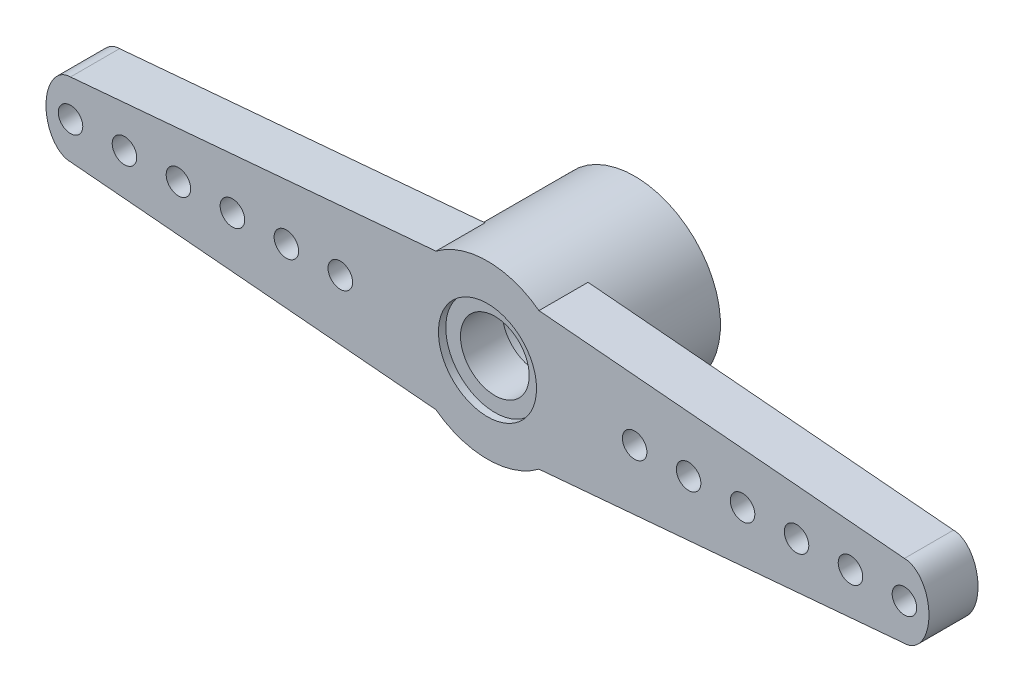
from build123d import *
from build123d.topology import SkipClean

# Parameters (mm, degrees)
CROQUIS1_R              = 0.5
SALIENTE_EXTRUIR1_DEPTH = 2
SALIENTE_EXTRUIR2_START = 4
CROQUIS3_R              = 3.5
CROQUIS3_R_2            = 2.25
SALIENTE_EXTRUIR2_DEPTH = 4
CROQUIS4_R              = 1.4
CORTAR_EXTRUIR1_DEPTH   = 19.768324494
CROQUIS5_R              = 2
CORTAR_EXTRUIR2_DEPTH   = 0.3
CORTAR_EXTRUIR4_DEPTH   = 2


with BuildPart() as part:
    # Croquis1 → Saliente-Extruir1 (new body)
    with BuildSketch(Plane.XY):
        with BuildLine():
            Line((-2.1, 2.8), (-17, 1.5))
            add(Edge.make_bspline(
                [(-17, 1.5), (-18, 1.5), (-18, 0), (-18, -1.5), (-17, -1.5)],
                knots=[3.141592654, 3.141592654, 3.141592654, 4.71238898, 4.71238898, 6.283185307, 6.283185307, 6.283185307], degree=2, weights=[1, 0.707106781, 1, 0.707106781, 1]))
            Line((-17, -1.5), (-2.1, -2.8))
            ThreePointArc((-2.1, -2.8), (0, -3.5), (2.1, -2.8))
            Line((2.1, -2.8), (17, -1.5))
            add(Edge.make_bspline(
                [(17, -1.5), (18, -1.5), (18, 0), (18, 1.5), (17, 1.5)],
                knots=[3.141592654, 3.141592654, 3.141592654, 4.71238898, 4.71238898, 6.283185307, 6.283185307, 6.283185307], degree=2, weights=[1, 0.707106781, 1, 0.707106781, 1]))
            Line((17, 1.5), (2.1, 2.8))
            ThreePointArc((2.1, 2.8), (0, 3.5), (-2.1, 2.8))
        make_face()
        with Locations((-17, 0)):
            Circle(CROQUIS1_R, mode=Mode.SUBTRACT)
        with Locations((-14.8, 0)):
            Circle(CROQUIS1_R, mode=Mode.SUBTRACT)
        with Locations((-12.6, 0)):
            Circle(CROQUIS1_R, mode=Mode.SUBTRACT)
        with Locations((-10.4, 0)):
            Circle(CROQUIS1_R, mode=Mode.SUBTRACT)
        with Locations((-8.2, 0)):
            Circle(CROQUIS1_R, mode=Mode.SUBTRACT)
        with Locations((-6, 0)):
            Circle(CROQUIS1_R, mode=Mode.SUBTRACT)
        with Locations(Location((6, 0, 0), (0, 0, 180))):
            Circle(CROQUIS1_R, mode=Mode.SUBTRACT)
        with Locations(Location((8.2, 0, 0), (0, 0, 180))):
            Circle(CROQUIS1_R, mode=Mode.SUBTRACT)
        with Locations(Location((10.4, 0, 0), (0, 0, 180))):
            Circle(CROQUIS1_R, mode=Mode.SUBTRACT)
        with Locations(Location((12.6, 0, 0), (0, 0, 180))):
            Circle(CROQUIS1_R, mode=Mode.SUBTRACT)
        with Locations(Location((14.8, 0, 0), (0, 0, 180))):
            Circle(CROQUIS1_R, mode=Mode.SUBTRACT)
        with Locations(Location((17, 0, 0), (0, 0, 180))):
            Circle(CROQUIS1_R, mode=Mode.SUBTRACT)
    extrude(amount=SALIENTE_EXTRUIR1_DEPTH)

    # Croquis3 → Saliente-Extruir2 (add)
    with SkipClean():  # the faces are left unmerged after this step: merging them gives an invalid solid
        with BuildSketch(Plane(origin=(0, 0, 0), x_dir=(-1, 0, 0), z_dir=(0, 0, -1)).offset(SALIENTE_EXTRUIR2_START)):
            Circle(CROQUIS3_R)
            Circle(CROQUIS3_R_2, mode=Mode.SUBTRACT)
        extrude(amount=-SALIENTE_EXTRUIR2_DEPTH)

    # Croquis4 → Cortar-Extruir1 (cut, through all)
    with SkipClean():  # the faces are left unmerged after this step: merging them gives an invalid solid
        with BuildSketch(Plane(origin=(0, 0, 0), x_dir=(-1, 0, 0), z_dir=(0, 0, -1))):
            Circle(CROQUIS4_R)
        extrude(amount=-CORTAR_EXTRUIR1_DEPTH, mode=Mode.SUBTRACT)

    # Croquis5 → Cortar-Extruir2 (cut)
    with SkipClean():  # the faces are left unmerged after this step: merging them gives an invalid solid
        with BuildSketch(Plane.XY.offset(2)):
            Circle(CROQUIS5_R)
        extrude(amount=-CORTAR_EXTRUIR2_DEPTH, mode=Mode.SUBTRACT)

    # Croquis6 → Cortar-Extruir4 (cut)
    with SkipClean():  # the faces are left unmerged after this step: merging them gives an invalid solid
        with BuildSketch(Plane(origin=(0, 0, -4), x_dir=(-1, 0, 0), z_dir=(0, 0, -1))):
            Polygon((0, -2.25), (0.10043817, -2.397897449), (0.167368384, -2.394157017), (0.234167805, -2.388546162), (0.31304517, -2.228109749), (0.433089229, -2.360589579), (0.498847515, -2.347570664), (0.564215969, -2.33271773), (0.619997273, -2.162865066), (0.757310699, -2.277348707), (0.820617148, -2.255304706), (0.883282311, -2.23149879), (0.914881833, -2.055535863), (1.066791978, -2.149795022), (1.126414401, -2.119154997), (1.185156568, -2.086859453), (1.191959259, -1.908211182), (1.355509365, -1.980411211), (1.410287279, -1.941771536), (1.4639631, -1.90161496), (1.445836554, -1.723758531), (1.617843304, -1.772494138), (1.666710519, -1.72660689), (1.714275256, -1.679370884), (1.671572286, -1.505768069), (1.848687763, -1.530090672), (1.890693135, -1.477848993), (1.931220994, -1.424452954), (1.864772764, -1.258482734), (2.043549617, -1.257918921), (2.07787556, -1.200339636), (2.110577712, -1.141822856), (2.021677561, -0.986715653), (2.198636103, -0.961276398), (2.2246145, -0.899480223), (2.248854435, -0.836981664), (2.139232704, -0.695756463), (2.310928638, -0.645936912), (2.32805385, -0.581126639), (2.343359765, -0.515862765), (2.215150116, -0.391268354), (2.378241576, -0.318038189), (2.38618028, -0.251475276), (2.392254263, -0.184716373), (2.247952151, -0.079177841), (2.399264746, 0.016037597), (2.397862424, 0.083057578), (2.394586253, 0.150012123), (2.237000354, 0.234440589), (2.373588958, 0.349788041), (2.362872904, 0.415960623), (2.350310345, 0.481807615), (2.18250789, 0.543482711), (2.30171396, 0.676717069), (2.281892751, 0.740754277), (2.260288319, 0.804212081), (2.085535392, 0.841933371), (2.185038718, 0.990461379), (2.156498151, 1.051116803), (2.126272353, 1.110950284), (1.94797032, 1.123983566), (2.025834183, 1.284914297), (1.989129768, 1.341007347), (1.950870913, 1.396051915), (1.772490222, 1.384143511), (1.82719909, 1.55434463), (1.783045236, 1.604783519), (1.737497991, 1.653967793), (1.562510617, 1.617349487), (1.592999645, 1.793508224), (1.542255757, 1.837311216), (1.490306646, 1.879677881), (1.322118521, 1.819062407), (1.327794274, 1.997750031), (1.271448023, 2.034064551), (1.214108178, 2.068788988), (1.055992892, 1.985356156), (1.036744898, 2.163094717), (0.975893001, 2.191213944), (0.914278475, 2.217620281), (0.769313562, 2.112994017), (0.725516462, 2.286324036), (0.661343331, 2.305700661), (0.596653382, 2.323274929), (0.467660419, 2.199491664), (0.400166673, 2.365039469), (0.333921365, 2.375296349), (0.267415109, 2.383696484), (0.156904797, 2.243165519), (0.067028095, 2.397708909), (0, 2.398646405), (-0.067028095, 2.397708909), (-0.156904797, 2.243165519), (-0.267415109, 2.383696484), (-0.333921365, 2.375296349), (-0.400166673, 2.365039469), (-0.467660419, 2.199491664), (-0.596653382, 2.323274929), (-0.661343331, 2.305700661), (-0.725516462, 2.286324036), (-0.769313562, 2.112994017), (-0.914278475, 2.217620281), (-0.975893001, 2.191213944), (-1.036744898, 2.163094717), (-1.055992892, 1.985356156), (-1.214108178, 2.068788988), (-1.271448023, 2.034064551), (-1.327794274, 1.997750031), (-1.322118521, 1.819062407), (-1.490306646, 1.879677881), (-1.542255757, 1.837311216), (-1.592999645, 1.793508224), (-1.562510617, 1.617349487), (-1.737497991, 1.653967793), (-1.783045236, 1.604783519), (-1.82719909, 1.55434463), (-1.772490222, 1.384143511), (-1.950870913, 1.396051915), (-1.989129768, 1.341007347), (-2.025834183, 1.284914297), (-1.94797032, 1.123983566), (-2.126272353, 1.110950284), (-2.156498151, 1.051116803), (-2.185038718, 0.990461379), (-2.085535392, 0.841933371), (-2.260288319, 0.804212081), (-2.281892751, 0.740754277), (-2.30171396, 0.676717069), (-2.18250789, 0.543482711), (-2.350310345, 0.481807615), (-2.362872904, 0.415960623), (-2.373588958, 0.349788041), (-2.237000354, 0.234440589), (-2.394586253, 0.150012123), (-2.397862424, 0.083057578), (-2.399264746, 0.016037597), (-2.247952151, -0.079177841), (-2.392254263, -0.184716373), (-2.38618028, -0.251475276), (-2.378241576, -0.318038189), (-2.215150116, -0.391268354), (-2.343359765, -0.515862765), (-2.32805385, -0.581126639), (-2.310928638, -0.645936912), (-2.139232704, -0.695756463), (-2.248854435, -0.836981664), (-2.2246145, -0.899480223), (-2.198636103, -0.961276398), (-2.021677561, -0.986715653), (-2.110577712, -1.141822856), (-2.07787556, -1.200339636), (-2.043549617, -1.257918921), (-1.864772764, -1.258482734), (-1.931220994, -1.424452954), (-1.890693135, -1.477848993), (-1.848687763, -1.530090672), (-1.671572286, -1.505768069), (-1.714275256, -1.679370884), (-1.666710519, -1.72660689), (-1.617843304, -1.772494138), (-1.445836554, -1.723758531), (-1.4639631, -1.90161496), (-1.410287279, -1.941771536), (-1.355509365, -1.980411211), (-1.191959259, -1.908211182), (-1.185156568, -2.086859453), (-1.126414401, -2.119154997), (-1.066791978, -2.149795022), (-0.914881833, -2.055535863), (-0.883282311, -2.23149879), (-0.820617148, -2.255304706), (-0.757310699, -2.277348707), (-0.619997273, -2.162865066), (-0.564215969, -2.33271773), (-0.498847515, -2.347570664), (-0.433089229, -2.360589579), (-0.31304517, -2.228109749), (-0.234167805, -2.388546162), (-0.167368384, -2.394157017), (-0.10043817, -2.397897449), align=None)
        extrude(amount=-CORTAR_EXTRUIR4_DEPTH, mode=Mode.SUBTRACT)


solid = part.part
